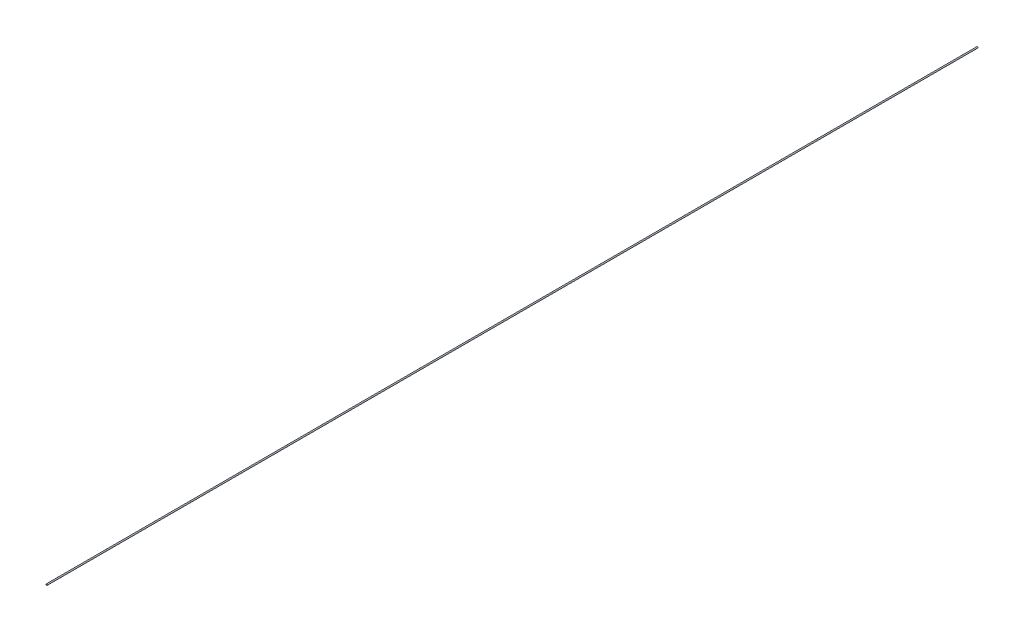
from build123d import *

# Parameters (mm, degrees)
SKETCH_1_R      = 6
EXTRUDE_1_DEPTH = 9000


with BuildPart() as part:
    # Эскиз1 → Бобышка-Вытянуть1 (new body)
    with BuildSketch(Plane.XY):
        Circle(SKETCH_1_R)
    extrude(amount=-EXTRUDE_1_DEPTH)


solid = part.part
